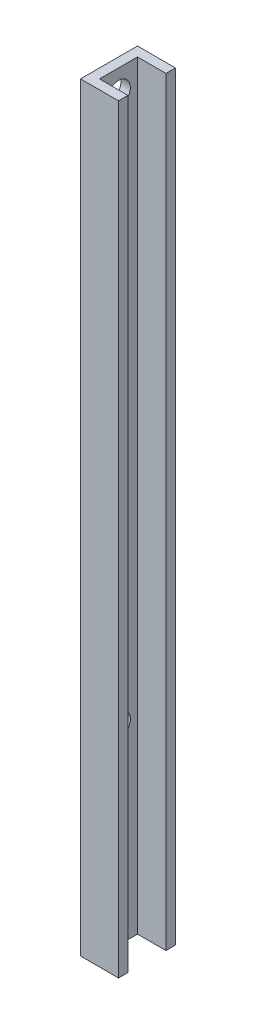
from build123d import *

# Parameters (mm, degrees)
BOSS_EXTRUDE1_DEPTH = 254
SKETCH5_R           = 3.96875
CUT_EXTRUDE1_DEPTH  = 12.7


with BuildPart() as part:
    # Sketch1 → Boss-Extrude1 (new body)
    with BuildSketch(Plane(origin=(0, 0, 0), x_dir=(1, 0, 0), z_dir=(0, 1, 0))):
        Polygon((0, 0), (12.7, 0), (12.7, 3.175), (3.175, 3.175), (3.175, 15.875), (12.7, 15.875), (12.7, 19.05), (0, 19.05), align=None)
    extrude(amount=BOSS_EXTRUDE1_DEPTH)

    # Sketch5 → Cut-Extrude1 (cut)
    with BuildSketch(Plane(origin=(3.175, 0, 0), x_dir=(0, 0, -1), z_dir=(1, 0, 0))):
        with Locations((9.525, 63.5)):
            Circle(SKETCH5_R)
        with Locations((9.525, 246.38)):
            Circle(SKETCH5_R)
    extrude(amount=-CUT_EXTRUDE1_DEPTH, mode=Mode.SUBTRACT)


solid = part.part
